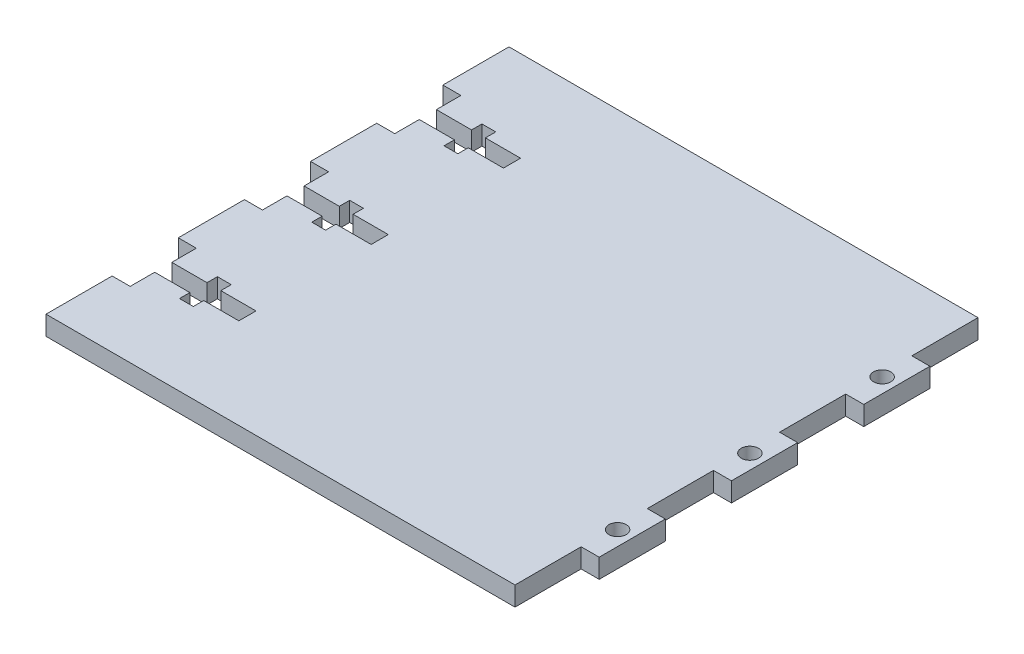
from build123d import *

# Parameters (mm, degrees)
SKETCH1_W           = 75
SKETCH1_H           = 77
BOSS_EXTRUDE1_DEPTH = 3.2
SKETCH2_W           = 3
SKETCH2_H           = 11
BOSS_EXTRUDE3_DEPTH = 3.2
LPATTERN1_COUNT     = 4
LPATTERN1_PITCH     = 22
SKETCH5_W           = 14
SKETCH5_H           = 2.85
SKETCH5_W_2         = 2.3
SKETCH5_H_2         = 6.3
CUT_EXTRUDE1_DEPTH  = 56.970885289
LPATTERN3_COUNT     = 3
LPATTERN3_PITCH     = 22
SKETCH4_W           = 3
SKETCH4_H           = 11
BOSS_EXTRUDE6_DEPTH = 3.2
SKETCH7_R           = 1.44
CUT_EXTRUDE2_DEPTH  = 56.970885289
LPATTERN7_COUNT     = 3
LPATTERN7_PITCH     = 22
LPATTERN8_COUNT     = 3
LPATTERN8_PITCH     = 22


with BuildPart() as part:
    # Sketch1 → Boss-Extrude1 (new body)
    with BuildSketch(Plane(origin=(0, 0, 0), x_dir=(1, 0, 0), z_dir=(0, 1, 0))):
        Rectangle(SKETCH1_W, SKETCH1_H)
    extrude(amount=BOSS_EXTRUDE1_DEPTH)

    # Sketch2 → Boss-Extrude3 (add)
    with BuildSketch(Plane(origin=(0, 3.2, 0), x_dir=(1, 0, 0), z_dir=(0, 1, 0))):
        with Locations((-39, 33)):
            Rectangle(SKETCH2_W, SKETCH2_H)
    boss_extrude3 = extrude(amount=-BOSS_EXTRUDE3_DEPTH)

    # LPattern1: Boss-Extrude3 ×4
    with Locations(*[(0, 0, i * LPATTERN1_PITCH) for i in range(1, LPATTERN1_COUNT)]):
        add(boss_extrude3)

    # Sketch5 → Cut-Extrude1 (cut, through all)
    with BuildSketch(Plane(origin=(0, 3.2, 0), x_dir=(1, 0, 0), z_dir=(0, 1, 0))):
        with Locations((-30.5, 22)):
            Rectangle(SKETCH5_W, SKETCH5_H)
        with Locations((-30.5, 22)):
            Rectangle(SKETCH5_W_2, SKETCH5_H_2)
    cut_extrude1 = extrude(amount=-CUT_EXTRUDE1_DEPTH, mode=Mode.SUBTRACT)

    # LPattern3: Cut-Extrude1 ×3
    with Locations(*[(0, 0, i * LPATTERN3_PITCH) for i in range(1, LPATTERN3_COUNT)]):
        add(cut_extrude1, mode=Mode.SUBTRACT)

    # Sketch4 → Boss-Extrude6 (add)
    with BuildSketch(Plane(origin=(0, 3.2, 0), x_dir=(1, 0, 0), z_dir=(0, 1, 0))):
        with Locations((39, 22)):
            Rectangle(SKETCH4_W, SKETCH4_H)
    boss_extrude6 = extrude(amount=-BOSS_EXTRUDE6_DEPTH)

    # Sketch7 → Cut-Extrude2 (cut, through all)
    with BuildSketch(Plane(origin=(0, 3.2, 0), x_dir=(1, 0, 0), z_dir=(0, 1, 0))):
        with Locations(Location((38.06, 22, 0), (0, 0, 270))):
            Circle(SKETCH7_R)
    cut_extrude2 = extrude(amount=-CUT_EXTRUDE2_DEPTH, mode=Mode.SUBTRACT)

    # LPattern7: Boss-Extrude6 ×3
    with Locations(*[(0, 0, i * LPATTERN7_PITCH) for i in range(1, LPATTERN7_COUNT)]):
        add(boss_extrude6)

    # LPattern8: Cut-Extrude2 ×3
    with Locations(*[(0, 0, i * LPATTERN8_PITCH) for i in range(1, LPATTERN8_COUNT)]):
        add(cut_extrude2, mode=Mode.SUBTRACT)


solid = part.part
